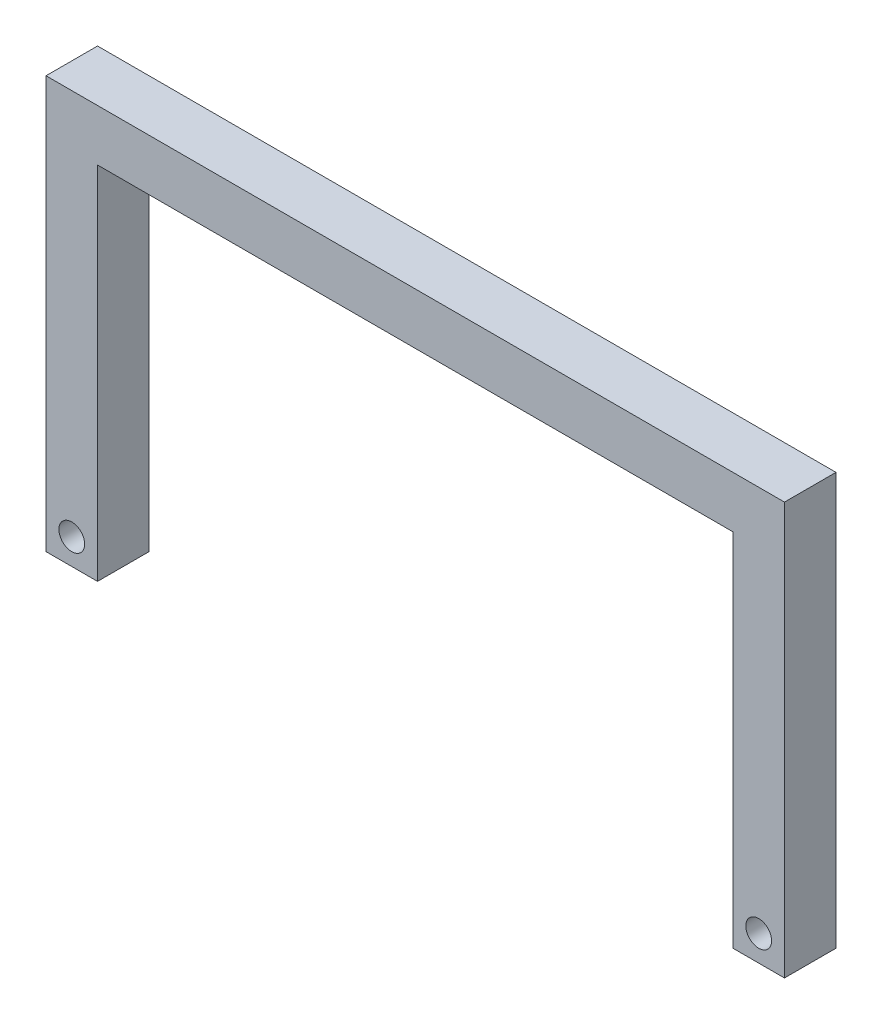
from build123d import *

# Parameters (mm, degrees)
SKETCH1_R           = 7.5
BOSS_EXTRUDE1_DEPTH = 15


with BuildPart() as part:
    # Sketch1 → Boss-Extrude1 (new, symmetric)
    with BuildSketch(Plane.XY):
        Polygon((-185, -225), (-185, -15), (185, -15), (185, -225), (215, -225), (215, -15), (215, 15), (-215, 15), (-215, -15), (-215, -225), align=None)
        with Locations((-200, -210)):
            Circle(SKETCH1_R, mode=Mode.SUBTRACT)
        with Locations((200, -210)):
            Circle(SKETCH1_R, mode=Mode.SUBTRACT)
    extrude(amount=BOSS_EXTRUDE1_DEPTH, both=True)


solid = part.part
